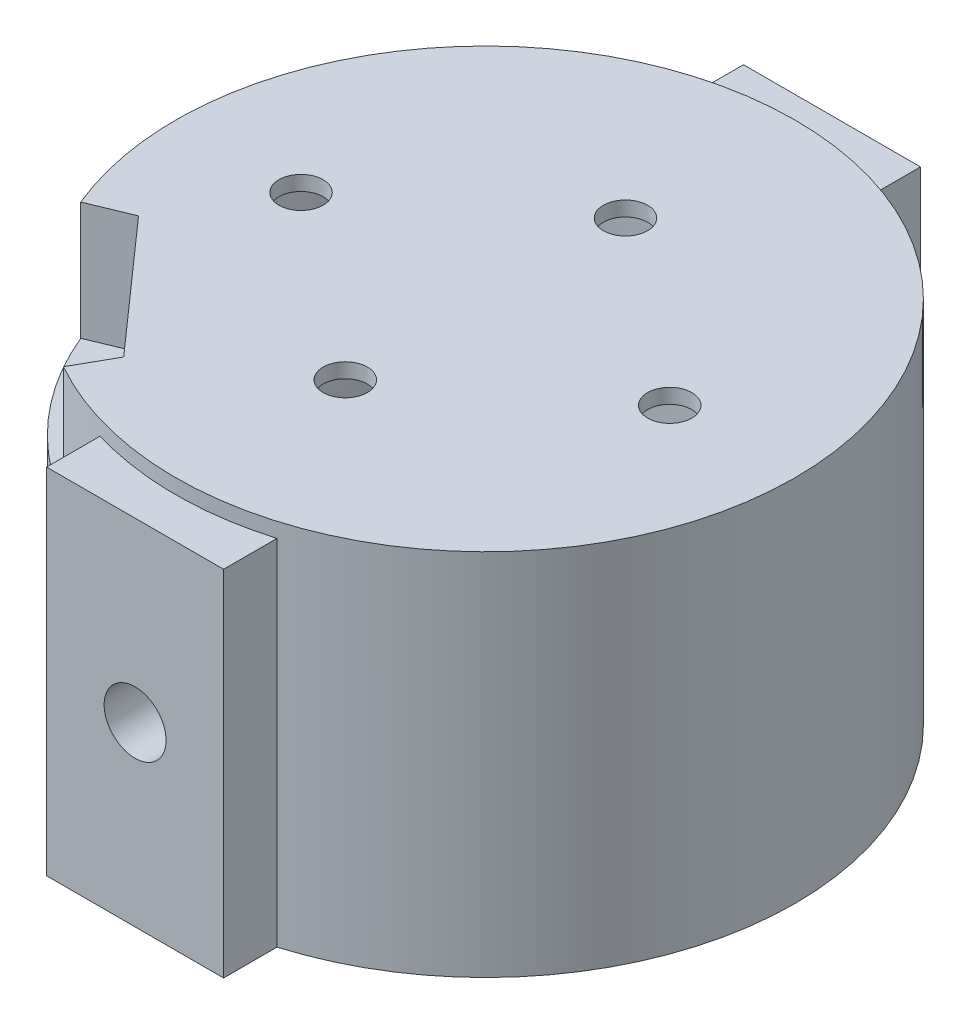
from build123d import *

# Parameters (mm, degrees)
SKETCH1_R           = 21
SKETCH1_R_2         = 17.75
BOSS_EXTRUDE2_DEPTH = 12
SKETCH5_W           = 12
SKETCH5_H           = 6
BOSS_EXTRUDE7_DEPTH = 12
SKETCH6_W           = 12
SKETCH6_H           = 6
BOSS_EXTRUDE8_DEPTH = 12
SKETCH7_R           = 2.1
CUT_EXTRUDE1_DEPTH  = 54.080716838
BOSS_EXTRUDE9_START = 1
SKETCH8_R           = 21
BOSS_EXTRUDE9_DEPTH = 1
CUT_EXTRUDE2_REACH  = 42.374
SKETCH9_R           = 1.5
CUT_EXTRUDE6_START  = 5
CUT_EXTRUDE6_DEPTH  = 30.2645955


with BuildPart() as part:
    # Sketch1 → Boss-Extrude2 (new, symmetric)
    with BuildSketch(Plane(origin=(0, 0, 0), x_dir=(1, 0, 0), z_dir=(0, 1, 0))):
        Circle(SKETCH1_R)
        Circle(SKETCH1_R_2, mode=Mode.SUBTRACT)
    extrude(amount=BOSS_EXTRUDE2_DEPTH, both=True)

    # Sketch6 → Boss-Extrude8 (add, symmetric)
    with BuildSketch(Plane(origin=(0, 0, 0), x_dir=(1, 0, 0), z_dir=(0, 1, 0))):
        with Locations((0, -20.75)):
            Rectangle(SKETCH6_W, SKETCH6_H)
    extrude(amount=BOSS_EXTRUDE8_DEPTH, both=True)


with BuildPart() as body_2:
    # Sketch5 → Boss-Extrude7 (new, symmetric)
    with BuildSketch(Plane(origin=(0, 0, 0), x_dir=(1, 0, 0), z_dir=(0, 1, 0))):
        with Locations((0, 20.5)):
            Rectangle(SKETCH5_W, SKETCH5_H)
    extrude(amount=BOSS_EXTRUDE7_DEPTH, both=True)


with BuildPart() as cut_extrude1_tool:
    # Sketch7 → Cut-Extrude1 (new, through all)
    with BuildSketch(Plane(origin=(0, 0, -23.5), x_dir=(-1, 0, 0), z_dir=(0, 0, -1))):
        Circle(SKETCH7_R)
    extrude(amount=-CUT_EXTRUDE1_DEPTH)


with BuildPart() as part_1:
    add(part.part)

    # Cut-Extrude1: cut by cut_extrude1_tool
    add(cut_extrude1_tool.part, mode=Mode.SUBTRACT)



with BuildPart() as body_2_1:
    add(body_2.part)

    # Cut-Extrude1: cut by cut_extrude1_tool
    add(cut_extrude1_tool.part, mode=Mode.SUBTRACT)


with BuildPart() as part_2:
    add(part_1.part)

    add(body_2_1.part)  # Boss-Extrude9 merges body 2
    # Sketch8 → Boss-Extrude9 (add)
    with BuildSketch(Plane(origin=(0, 12, 0), x_dir=(1, 0, 0), z_dir=(0, 1, 0)).offset(BOSS_EXTRUDE9_START)):
        Circle(SKETCH8_R)
    extrude(amount=-BOSS_EXTRUDE9_DEPTH)

    # Sketch9 → Cut-Extrude2 (cut, up to next)
    with BuildSketch(Plane(origin=(0, 13, 0), x_dir=(1, 0, 0), z_dir=(0, 1, 0)), mode=Mode.PRIVATE) as cut_extrude2_sk1:
        with Locations((0, 9.5)):
            Circle(SKETCH9_R)
    cut_extrude2_tool1 = extrude(cut_extrude2_sk1.sketch, amount=-CUT_EXTRUDE2_REACH, mode=Mode.PRIVATE) & part_2.part
    # Sketch9 → Cut-Extrude2 (cut, up to next)
    with BuildSketch(Plane(origin=(0, 13, 0), x_dir=(1, 0, 0), z_dir=(0, 1, 0)), mode=Mode.PRIVATE) as cut_extrude2_sk2:
        with Locations((0, -9.5)):
            Circle(SKETCH9_R)
    cut_extrude2_tool2 = extrude(cut_extrude2_sk2.sketch, amount=-CUT_EXTRUDE2_REACH, mode=Mode.PRIVATE) & part_2.part
    # Sketch9 → Cut-Extrude2 (cut, up to next)
    with BuildSketch(Plane(origin=(0, 13, 0), x_dir=(1, 0, 0), z_dir=(0, 1, 0)), mode=Mode.PRIVATE) as cut_extrude2_sk3:
        with Locations((-12.5, 0)):
            Circle(SKETCH9_R)
    cut_extrude2_tool3 = extrude(cut_extrude2_sk3.sketch, amount=-CUT_EXTRUDE2_REACH, mode=Mode.PRIVATE) & part_2.part
    # Sketch9 → Cut-Extrude2 (cut, up to next)
    with BuildSketch(Plane(origin=(0, 13, 0), x_dir=(1, 0, 0), z_dir=(0, 1, 0)), mode=Mode.PRIVATE) as cut_extrude2_sk4:
        with Locations((12.5, 0)):
            Circle(SKETCH9_R)
    cut_extrude2_tool4 = extrude(cut_extrude2_sk4.sketch, amount=-CUT_EXTRUDE2_REACH, mode=Mode.PRIVATE) & part_2.part
    add(cut_extrude2_tool1.solids().sort_by_distance((0, 13, -9.5))[0], mode=Mode.SUBTRACT)
    add(cut_extrude2_tool2.solids().sort_by_distance((0, 13, 9.5))[0], mode=Mode.SUBTRACT)
    add(cut_extrude2_tool3.solids().sort_by_distance((-12.5, 13, 0))[0], mode=Mode.SUBTRACT)
    add(cut_extrude2_tool4.solids().sort_by_distance((12.5, 13, 0))[0], mode=Mode.SUBTRACT)

    # Sketch12 → Cut-Extrude6 (cut, through all)
    with BuildSketch(Plane(origin=(0, 0, 0), x_dir=(1, 0, 0), z_dir=(0, 1, 0)).offset(CUT_EXTRUDE6_START)):
        with BuildLine():
            Line((-19.403691202, -8.030987969), (-16.631735316, -6.883703973))
            Line((-16.631735316, -6.883703973), (-8.848918103, -15.674713663))
            Line((-8.848918103, -15.674713663), (-10.323737787, -18.28716594))
            ThreePointArc((-10.323737787, -18.28716594), (-15.723463525, -13.920226104), (-19.403691202, -8.030987969))
        make_face()
    extrude(amount=CUT_EXTRUDE6_DEPTH, mode=Mode.SUBTRACT)


solid = part_2.part
